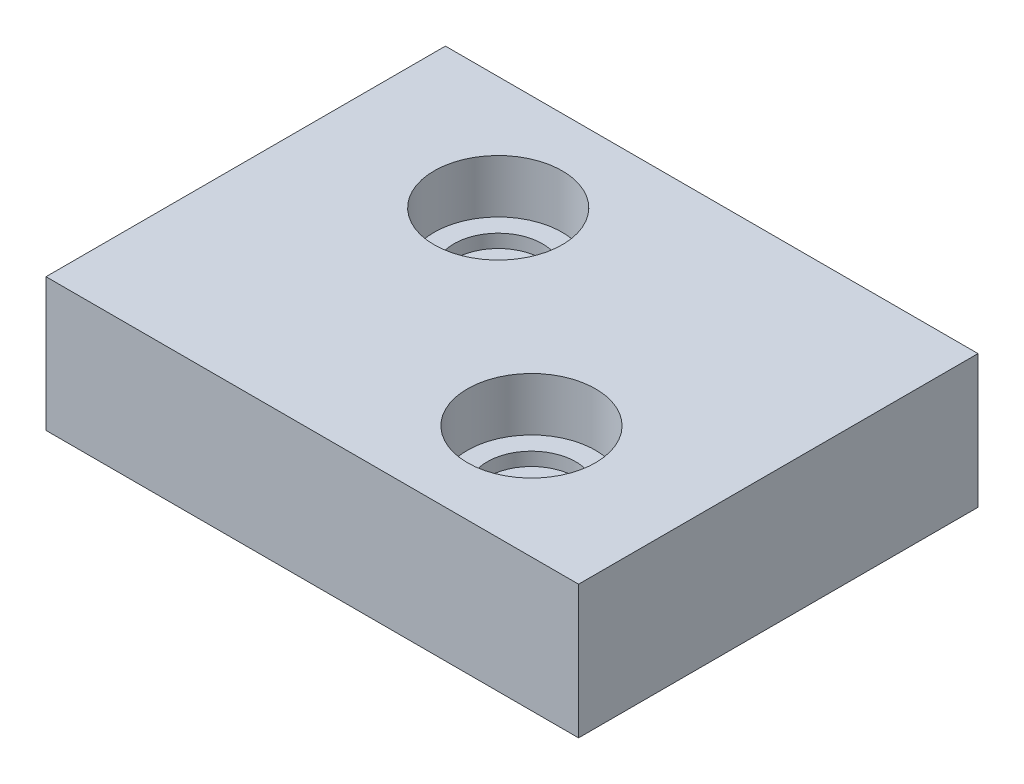
from build123d import *

# Parameters (mm, degrees)
SKETCH2_W           = 40
SKETCH2_H           = 30
BOSS_EXTRUDE1_DEPTH = 10
SKETCH3_R           = 1.55
CUT_EXTRUDE1_DEPTH  = 4
SKETCH4_R           = 4.8125
CUT_EXTRUDE2_DEPTH  = 4
SKETCH7_R           = 3.325
CUT_EXTRUDE3_DEPTH  = 1


with BuildPart() as part:
    # Sketch2 → Boss-Extrude1 (new body)
    with BuildSketch(Plane(origin=(0, 0, 0), x_dir=(1, 0, 0), z_dir=(0, 1, 0))):
        Rectangle(SKETCH2_W, SKETCH2_H)
    extrude(amount=BOSS_EXTRUDE1_DEPTH)

    # Sketch3 → Cut-Extrude1 (cut)
    with BuildSketch(Plane(origin=(0, 0, 0), x_dir=(-1, 0, 0), z_dir=(0, -1, 0))):
        with Locations(Location((-13.333333333, -10, 0), (0, 0, 90))):
            Circle(SKETCH3_R)
        with Locations(Location((13.333333333, -10, 0), (0, 0, 270))):
            Circle(SKETCH3_R)
        with Locations(Location((-13.333333333, 10, 0), (0, 0, 270))):
            Circle(SKETCH3_R)
        with Locations(Location((13.333333333, 10, 0), (0, 0, 90))):
            Circle(SKETCH3_R)
    extrude(amount=-CUT_EXTRUDE1_DEPTH, mode=Mode.SUBTRACT)

    # Sketch4 → Cut-Extrude2 (cut)
    with BuildSketch(Plane(origin=(0, 10, 0), x_dir=(1, 0, 0), z_dir=(0, 1, 0))):
        with Locations(Location((7.9286, -6.465, 0), (0, 0, 270))):
            Circle(SKETCH4_R)
        with Locations(Location((-7.5, 6.4636, 0), (0, 0, 270))):
            Circle(SKETCH4_R)
    extrude(amount=-CUT_EXTRUDE2_DEPTH, mode=Mode.SUBTRACT)

    # Sketch7 → Cut-Extrude3 (cut)
    with BuildSketch(Plane(origin=(0, 6, 0), x_dir=(1, 0, 0), z_dir=(0, 1, 0))):
        with Locations(Location((7.9286, -6.465, 0), (0, 0, 270))):
            Circle(SKETCH7_R)
        with Locations(Location((-7.5, 6.4636, 0), (0, 0, 270))):
            Circle(SKETCH7_R)
    extrude(amount=-CUT_EXTRUDE3_DEPTH, mode=Mode.SUBTRACT)


solid = part.part
